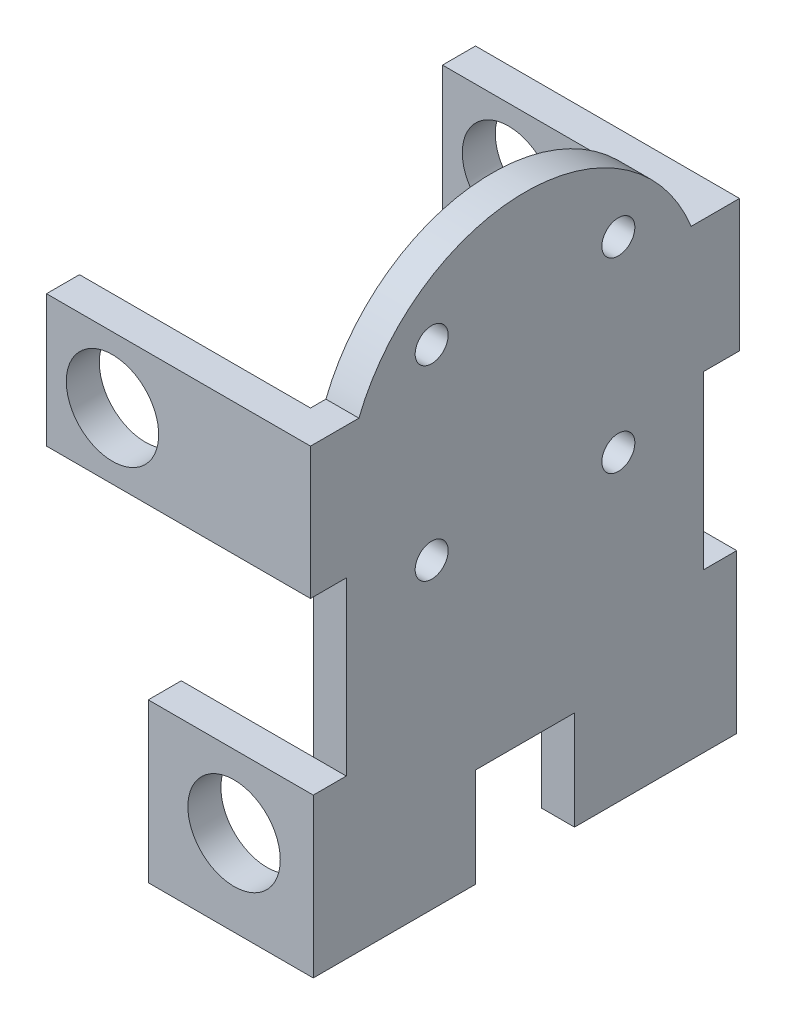
from build123d import *

# Parameters (mm, degrees)
BOSS_EXTRUDE1_DEPTH      = 2.5
BOSS_EXTRUDE1_DEPTH_BACK = 2.5
SKETCH2_R                = 2.5
CUT_EXTRUDE1_DEPTH       = 67.01762189
BOSS_EXTRUDE2_DEPTH      = 2.5
BOSS_EXTRUDE2_DEPTH_BACK = 2.5
SKETCH3_W                = 65
SKETCH3_H                = 20
SKETCH5_W                = 5
SKETCH5_H                = 20
BOSS_EXTRUDE4_DEPTH      = 35
SKETCH6_R                = 7
CUT_EXTRUDE2_DEPTH       = 97.079394253
SKETCH7_W                = 15
SKETCH7_H                = 15
CUT_EXTRUDE3_DEPTH       = 77.689308251
SKETCH8_W                = 25
SKETCH8_H                = 24
BOSS_EXTRUDE5_DEPTH      = 5
CUT_EXTRUDE4_DEPTH       = 93.498791343
CUT_EXTRUDE4_DEPTH_BACK  = 93.498791343
SKETCH9_R                = 7


with BuildPart() as part:
    # Sketch1 → Boss-Extrude1 (new, two sides: drawn at the far end of the back side and taken through both)
    with BuildSketch(Plane(origin=(0, 0, 0), x_dir=(0, 0, -1), z_dir=(1, 0, 0)).offset(-BOSS_EXTRUDE1_DEPTH_BACK)):
        with BuildLine():
            Line((-27.08, 0), (-27.08, -60))
            Line((-27.08, -60), (27.08, -60))
            Line((27.08, -60), (27.08, 0))
            ThreePointArc((27.08, 0), (0, 27.08), (-27.08, 0))
        make_face()
    extrude(amount=BOSS_EXTRUDE1_DEPTH + BOSS_EXTRUDE1_DEPTH_BACK)

    # Sketch2 → Cut-Extrude1 (cut, through all)
    with BuildSketch(Plane(origin=(2.5, 0, 0), x_dir=(0, 0, -1), z_dir=(1, 0, 0))):
        with Locations((-14.142135624, 14.142135624)):
            Circle(SKETCH2_R)
        with Locations((14.142135624, 14.142135624)):
            Circle(SKETCH2_R)
        with Locations((14.142135624, -14.142135624)):
            Circle(SKETCH2_R)
        with Locations((-14.142135624, -14.142135624)):
            Circle(SKETCH2_R)
    extrude(amount=-CUT_EXTRUDE1_DEPTH, mode=Mode.SUBTRACT)

    # Sketch3 → Boss-Extrude2 (add, two sides: drawn at the far end of the back side and taken through both)
    with BuildSketch(Plane(origin=(0, 0, 0), x_dir=(0, 0, -1), z_dir=(1, 0, 0)).offset(-BOSS_EXTRUDE2_DEPTH_BACK)):
        Rectangle(SKETCH3_W, SKETCH3_H)
    extrude(amount=BOSS_EXTRUDE2_DEPTH + BOSS_EXTRUDE2_DEPTH_BACK)

    # Sketch5 → Boss-Extrude4 (add)
    with BuildSketch(Plane.ZY.offset(2.5)):
        with Locations((-30, 0)):
            Rectangle(SKETCH5_W, SKETCH5_H)
        with Locations((30, 0)):
            Rectangle(SKETCH5_W, SKETCH5_H)
    extrude(amount=BOSS_EXTRUDE4_DEPTH)

    # Sketch6 → Cut-Extrude2 (cut, through all)
    with BuildSketch(Plane(origin=(0, 0, -32.5), x_dir=(-1, 0, 0), z_dir=(0, 0, -1))):
        with Locations((27.5, 0)):
            Circle(SKETCH6_R)
    extrude(amount=-CUT_EXTRUDE2_DEPTH, mode=Mode.SUBTRACT)

    # Sketch7 → Cut-Extrude3 (cut, through all)
    with BuildSketch(Plane.ZY.offset(2.5)):
        with Locations((0, -52.5)):
            Rectangle(SKETCH7_W, SKETCH7_H)
    extrude(amount=-CUT_EXTRUDE3_DEPTH, mode=Mode.SUBTRACT)

    # Sketch8 → Boss-Extrude5 (add)
    with BuildSketch(Plane.XY.offset(27.08)):
        with Locations((-10, -48)):
            Rectangle(SKETCH8_W, SKETCH8_H)
    boss_extrude5 = extrude(amount=BOSS_EXTRUDE5_DEPTH)

    # Mirror1: Boss-Extrude5 across plane
    add(boss_extrude5.mirror(Plane.XY))

    # Sketch9 → Cut-Extrude4 (cut, two sides: drawn at the far end of the back side and taken through both)
    with BuildSketch(Plane(origin=(0, 0, 27.08), x_dir=(-1, 0, 0), z_dir=(0, 0, -1)).offset(-CUT_EXTRUDE4_DEPTH_BACK)):
        with Locations((9.5, -47)):
            Circle(SKETCH9_R)
    extrude(amount=CUT_EXTRUDE4_DEPTH + CUT_EXTRUDE4_DEPTH_BACK, mode=Mode.SUBTRACT)


solid = part.part
